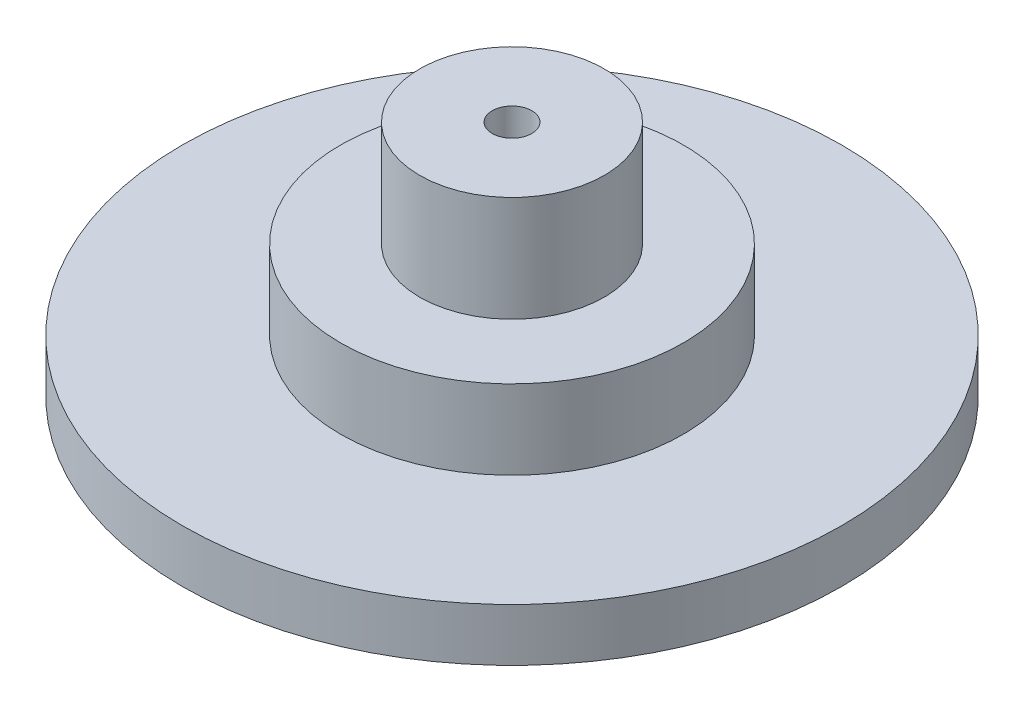
from build123d import *

# Parameters (mm, degrees)
SKETCH1_R           = 25
BOSS_EXTRUDE1_DEPTH = 4
SKETCH2_R           = 13
BOSS_EXTRUDE2_DEPTH = 6
SKETCH3_R           = 7
BOSS_EXTRUDE3_DEPTH = 8
SKETCH4_R           = 1.5
CUT_EXTRUDE1_DEPTH  = 40.67366885


with BuildPart() as part:
    # Sketch1 → Boss-Extrude1 (new body)
    with BuildSketch(Plane(origin=(0, 0, 0), x_dir=(1, 0, 0), z_dir=(0, 1, 0))):
        with Locations(Location((0, 0, 0), (0, 0, 270))):
            Circle(SKETCH1_R)
    extrude(amount=BOSS_EXTRUDE1_DEPTH)

    # Sketch2 → Boss-Extrude2 (add)
    with BuildSketch(Plane(origin=(0, 4, 0), x_dir=(1, 0, 0), z_dir=(0, 1, 0))):
        with Locations(Location((0, 0, 0), (0, 0, 270))):
            Circle(SKETCH2_R)
    extrude(amount=BOSS_EXTRUDE2_DEPTH)

    # Sketch3 → Boss-Extrude3 (add)
    with BuildSketch(Plane(origin=(0, 10, 0), x_dir=(1, 0, 0), z_dir=(0, 1, 0))):
        with Locations(Location((0, 0, 0), (0, 0, 270))):
            Circle(SKETCH3_R)
    extrude(amount=BOSS_EXTRUDE3_DEPTH)

    # Sketch4 → Cut-Extrude1 (cut, through all)
    with BuildSketch(Plane(origin=(0, 18, 0), x_dir=(1, 0, 0), z_dir=(0, 1, 0))):
        with Locations(Location((0, 0, 0), (0, 0, 270))):
            Circle(SKETCH4_R)
    extrude(amount=-CUT_EXTRUDE1_DEPTH, mode=Mode.SUBTRACT)


solid = part.part
